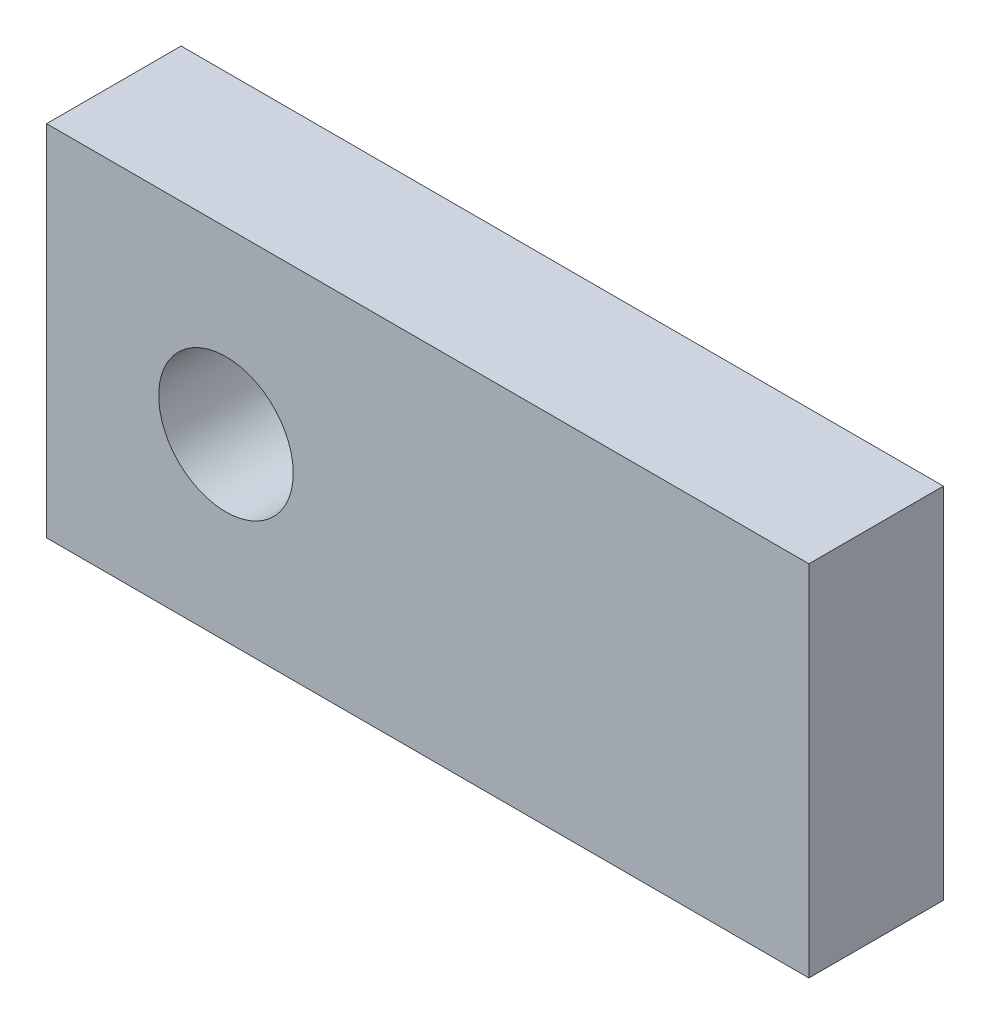
from build123d import *

# Parameters (mm, degrees)
SKETCH_1_W          = 17
SKETCH_1_H          = 8
EXTRUDE_1_DEPTH     = 3
SKETCH_2_R          = 1.5
CUT_EXTRUDE_1_DEPTH = 20.02629759


with BuildPart() as part:
    # Эскиз1 → Бобышка-Вытянуть1 (new body)
    with BuildSketch(Plane.XY):
        with Locations((8.5, 4)):
            Rectangle(SKETCH_1_W, SKETCH_1_H)
    extrude(amount=EXTRUDE_1_DEPTH)

    # Эскиз2 → Вырез-Вытянуть1 (cut, through all)
    with BuildSketch(Plane.XY.offset(3)):
        with Locations((4, 4)):
            Circle(SKETCH_2_R)
    extrude(amount=-CUT_EXTRUDE_1_DEPTH, mode=Mode.SUBTRACT)


solid = part.part
